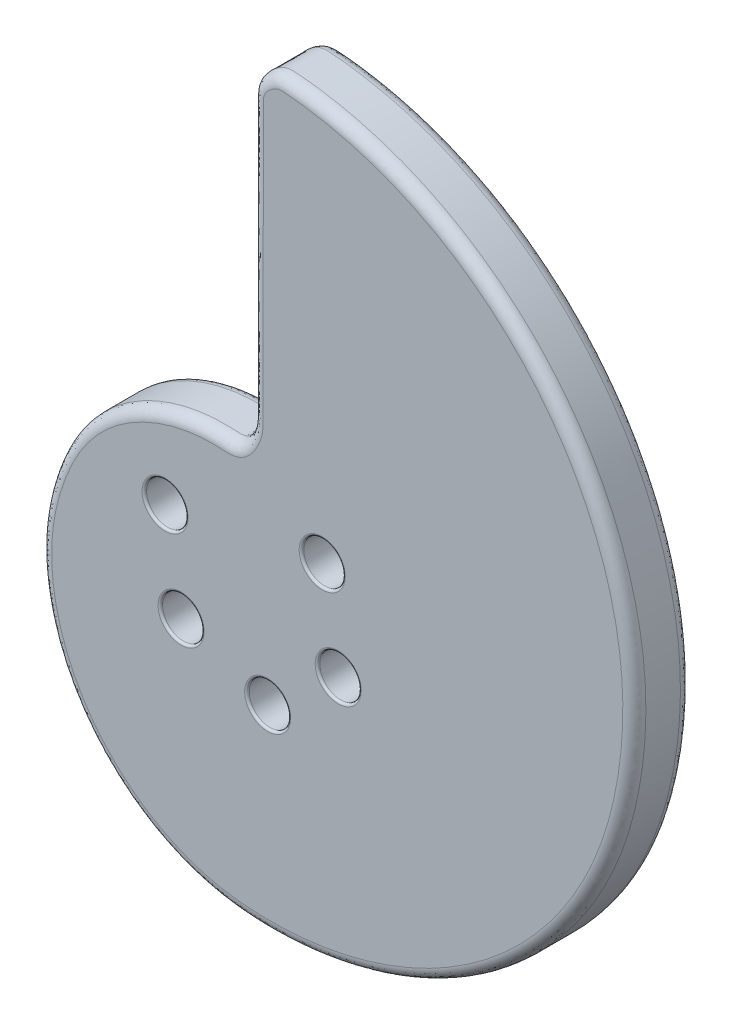
from build123d import *

# Parameters (mm, degrees)
EXTRUDE_2_DEPTH     = 5
SKETCH_5_R          = 1.8
CUT_EXTRUDE_1_DEPTH = 53.171284161
FILLET_1_R          = 0.2
FILLET_2_R          = 1


with BuildPart() as part:
    # 스케치2 → 보스-돌출2 (new body)
    with BuildSketch(Plane.XY):
        with BuildLine():
            add(Edge.make_bspline(
                [(9.110289991, -24.094266411), (17.225245849, -22.077131746), (23.906482794, -17.182880474), (28.29355906, -10.255311724), (29.794335013, -7.885458099), (32.16837178, -2.748359372), (33.608577876, 6.310607944), (33.002666714, 11.93367168), (32.351761457, 14.662198207), (29.232777389, 27.736652097), (19.490010248, 36.996668001), (6.27405271, 39.447764182), (5.929620284, 39.511644306), (5.238720804, 39.628434139), (4.197104163, 39.781783651), (3.026377895, 39.884829801), (1.73179626, 39.998777576), (0, 38.412716817), (0, 29.589210066), (0, 20.808730402), (0, 12.071277825), (-1.167866735, 10.241868942), (-2.027206466, 10.331964153), (-2.458022069, 10.358191974), (-5.501451186, 10.543474292), (-8.524999087, 9.812754719), (-11.212198037, 8.133632598), (-12.928521945, 7.061171089), (-15.921813277, 4.21311977), (-18.45346356, -2.607623937), (-18.465518089, -6.705278796), (-18.156249028, -8.705352318), (-17.22631721, -14.719313097), (-13.736550411, -19.704694238), (-8.404147818, -22.636925474), (-6.693016361, -23.577858388), (-2.984509257, -24.939175479), (3.338141603, -25.158131016), (7.215185185, -24.565332633), (9.110289991, -24.094266411)],
                knots=[0, 0, 0, 0, 0.13150775, 0.13150775, 0.13150775, 0.179619492, 0.227731233, 0.275842975, 0.275842975, 0.275842975, 0.481532564, 0.481532564, 0.481532564, 0.487540868, 0.493549171, 0.499557474, 0.507698306, 0.515839138, 0.52397997, 0.659035394, 0.666438243, 0.673841092, 0.681243941, 0.681243941, 0.681243941, 0.730077352, 0.730077352, 0.730077352, 0.761118871, 0.79216039, 0.823201908, 0.823201908, 0.823201908, 0.910145611, 0.910145611, 0.910145611, 0.940097074, 0.970048537, 1, 1, 1, 1], degree=3, weights=[0.945639436, 0.916942967, 0.935063155, 1, 1, 1, 1, 1, 1, 0.892207466, 0.892207466, 1, 1, 1, 1, 1, 1, 1, 1, 1, 1, 1, 1, 1, 0.933783923, 0.898535979, 0.894256169, 0.894256169, 0.894256169, 0.894256169, 0.894256169, 0.894256169, 0.83299517, 0.83299517, 0.894256169, 0.894256169, 0.894256169, 0.894256169, 0.894256169, 0.945639436]))
        make_face()
    extrude(amount=EXTRUDE_2_DEPTH)

    # 스케치5 → 컷-돌출1 (cut, through all)
    with BuildSketch(Plane.XY.offset(5)):
        with Locations((1.389185421, -7.878462024)):
            Circle(SKETCH_5_R)
        with Locations((-6.128355545, -5.142300877)):
            Circle(SKETCH_5_R)
        with Locations((-7.517540966, 2.736161147)):
            Circle(SKETCH_5_R)
        with Locations((6.128355545, 5.142300877)):
            Circle(SKETCH_5_R)
        with Locations((7.517540966, -2.736161147)):
            Circle(SKETCH_5_R)
    extrude(amount=-CUT_EXTRUDE_1_DEPTH, mode=Mode.SUBTRACT)

    # 필렛1
    fillet_1_edges = [part.edges().sort_by_distance(p)[0] for p in [
        (-7.928355545, -5.142300877, 0),
        (-7.928355545, -5.142300877, 5),
        (4.328355545, 5.142300877, 0),
        (4.328355545, 5.142300877, 5),
        (5.717540966, -2.736161147, 0),
        (5.717540966, -2.736161147, 5),
        (-9.317540966, 2.736161147, 0),
        (-9.317540966, 2.736161147, 5),
        (-0.410814579, -7.878462024, 0),
        (-0.410814579, -7.878462024, 5),
    ]]
    fillet(fillet_1_edges, radius=FILLET_1_R)

    # 필렛2
    fillet_2_edges = [part.edges().sort_by_distance(p)[0] for p in [
        (0.627954884, 38.902344538, 0),
        (0.627954884, 38.902344538, 5),
    ]]
    fillet(fillet_2_edges, radius=FILLET_2_R)


solid = part.part
